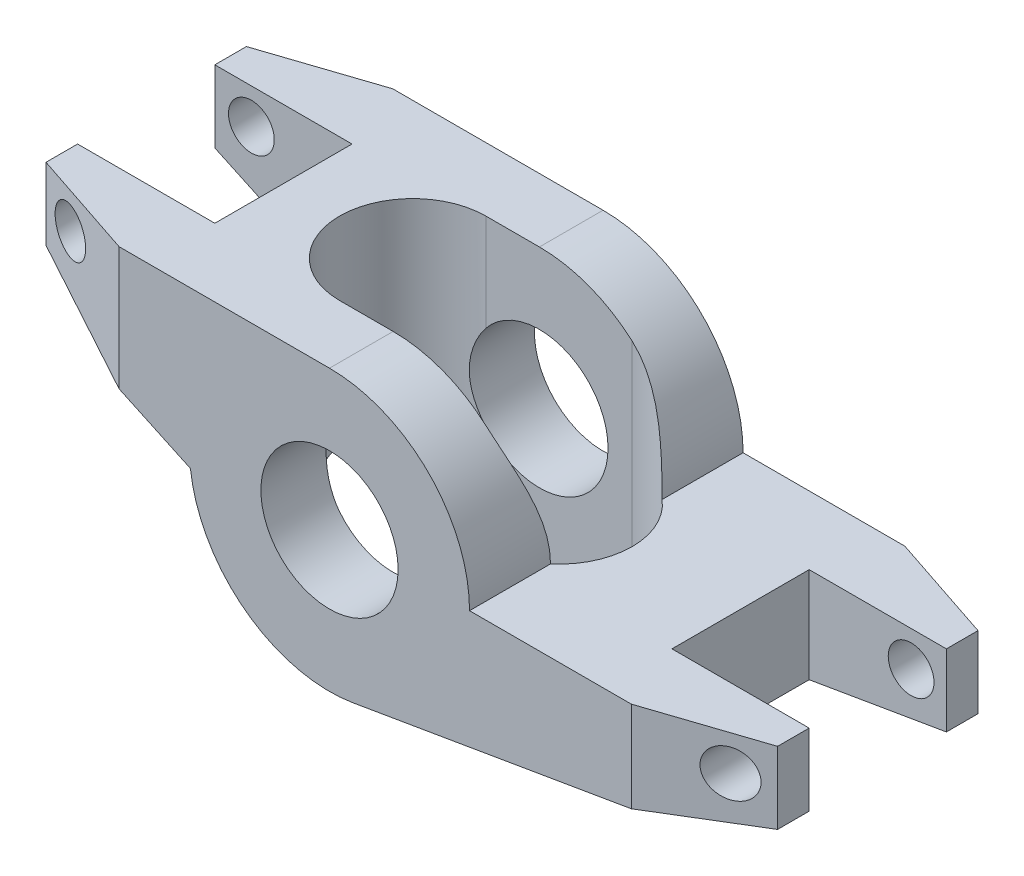
from build123d import *
from OCP.BRepFilletAPI import BRepFilletAPI_MakeChamfer

# Parameters (mm, degrees)
SKETCH2_R               = 4.765
BOSS_EXTRUDE1_DEPTH     = 9.5
CHAMFER1_SIZE           = 7.62
CHAMFER1_SIZE2          = 2.54
CHAMFER2_SIZE           = 2.54
CHAMFER2_SIZE2          = 7.62
SKETCH3_W               = 9.53
SKETCH3_H               = 9.53
CUT_EXTRUDE1_DEPTH      = 36.852041783
CUT_EXTRUDE2_DEPTH      = 32.648728647
CUT_EXTRUDE2_DEPTH_BACK = 32.648728647
CUT_EXTRUDE3_DEPTH      = 32.648728708
CUT_EXTRUDE3_DEPTH_BACK = 32.648728708
SKETCH5_R               = 1.59


with BuildPart() as part:
    # Sketch2 → Boss-Extrude1 (new, symmetric)
    with BuildSketch(Plane.XY):
        with BuildLine():
            Line((0, 9.725), (-22.23, 9.725))
            Line((-22.23, 9.725), (-22.23, 4.725))
            Line((-22.23, 4.725), (-9.658270439, -1.13729377))
            ThreePointArc((-9.658270439, -1.13729377), (-5.827126273, -7.785899075), (1.631914869, -9.587099606))
            Line((1.631914869, -9.587099606), (28.58, -5))
            Line((28.58, -5), (28.58, 0))
            Line((28.58, 0), (9.725, 0))
            ThreePointArc((9.725, 0), (6.876613447, 6.876613447), (0, 9.725))
        make_face()
        Circle(SKETCH2_R, mode=Mode.SUBTRACT)
    extrude(amount=BOSS_EXTRUDE1_DEPTH, both=True)

    # Chamfer1
    chamfer1_edges = [part.edges().sort_by_distance(p)[0] for p in [
        (-22.23, 7.225, -9.5),
        (28.58, -2.5, -9.5),
    ]]
    chamfer1_side = [part.faces().sort_by_distance(p)[0] for p in [
        (-11.115, 9.180944984, -9.5),
    ]]
    chamfer(chamfer1_edges, length=CHAMFER1_SIZE, length2=CHAMFER1_SIZE2, reference=chamfer1_side[0])

    # Chamfer2: one chamfer whose edges measure the first distance from different faces: ONE call of the kernel's chamfer builder (chamfer() names one face for all edges)
    chamfer2_edges_1 = [part.edges().sort_by_distance(p)[0] for p in [
        (-22.23, 7.225, 9.5),
    ]]
    chamfer2_side_1 = [part.faces().sort_by_distance(p)[0] for p in [
        (-22.23, 7.225, 1.27),
    ]]
    chamfer2_edges_2 = [part.edges().sort_by_distance(p)[0] for p in [
        (28.58, -2.5, 9.5),
    ]]
    chamfer2_side_2 = [part.faces().sort_by_distance(p)[0] for p in [
        (28.58, -2.5, 1.27),
    ]]
    chamfer2 = BRepFilletAPI_MakeChamfer(part.part.solid().wrapped)
    for e in chamfer2_edges_1:
        chamfer2.Add(CHAMFER2_SIZE, CHAMFER2_SIZE2, e.wrapped, chamfer2_side_1[0].wrapped)  # the first distance lies on this face
    for e in chamfer2_edges_2:
        chamfer2.Add(CHAMFER2_SIZE, CHAMFER2_SIZE2, e.wrapped, chamfer2_side_2[0].wrapped)  # the first distance lies on this face
    add(Compound.cast(chamfer2.Shape()), mode=Mode.REPLACE)

    # Sketch3 → Cut-Extrude1 (cut, through all)
    with BuildSketch(Plane(origin=(0, 9.725, 0), x_dir=(1, 0, 0), z_dir=(0, 1, 0))):
        with Locations((-17.465, 0)):
            Rectangle(SKETCH3_W, SKETCH3_H)
        with Locations((23.815, 0)):
            Rectangle(SKETCH3_W, SKETCH3_H)
    extrude(amount=-CUT_EXTRUDE1_DEPTH, mode=Mode.SUBTRACT)

    # Sketch4 → Cut-Extrude2 (cut, two sides: drawn at the far end of the back side and taken through both)
    with BuildSketch(Plane(origin=(0, 0, 0), x_dir=(1, 0, 0), z_dir=(0, 1, 0)).offset(-CUT_EXTRUDE2_DEPTH_BACK)):
        with BuildLine():
            Line((-3.72, 5.08), (6.44, 5.08))
            ThreePointArc((6.44, 5.08), (11.52, 0), (6.44, -5.08))
            Line((6.44, -5.08), (-3.72, -5.08))
            ThreePointArc((-3.72, -5.08), (-8.8, 0), (-3.72, 5.08))
        make_face()
    extrude(amount=CUT_EXTRUDE2_DEPTH + CUT_EXTRUDE2_DEPTH_BACK, mode=Mode.SUBTRACT)

    # Sketch5 → Cut-Extrude3 (cut, two sides: drawn at the far end of the back side and taken through both)
    with BuildSketch(Plane.XY.offset(-CUT_EXTRUDE3_DEPTH_BACK)):
        with Locations((-19.69, 7.275)):
            Circle(SKETCH5_R)
        with Locations((26.13, -2.45)):
            Circle(SKETCH5_R)
    extrude(amount=CUT_EXTRUDE3_DEPTH + CUT_EXTRUDE3_DEPTH_BACK, mode=Mode.SUBTRACT)


solid = part.part
